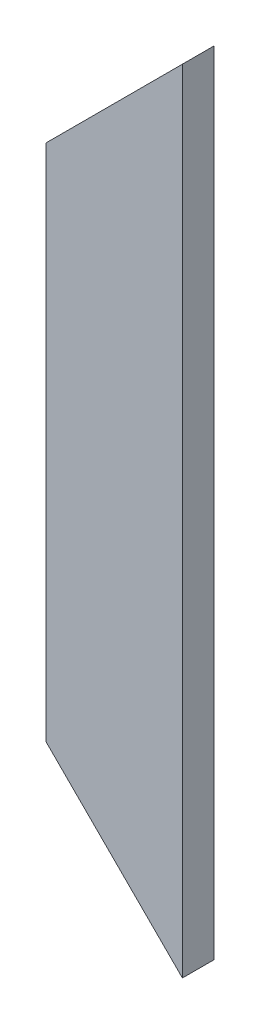
from build123d import *

# Parameters (mm, degrees)
BOSS_EXTRUDE1_DEPTH = 3


with BuildPart() as part:
    # Sketch1 → Boss-Extrude1 (new body)
    with BuildSketch(Plane.XY):
        Polygon((-13, 24.75), (-13, -24.75), (0, -37.75), (0, 37.75), align=None)
    extrude(amount=BOSS_EXTRUDE1_DEPTH)


solid = part.part
